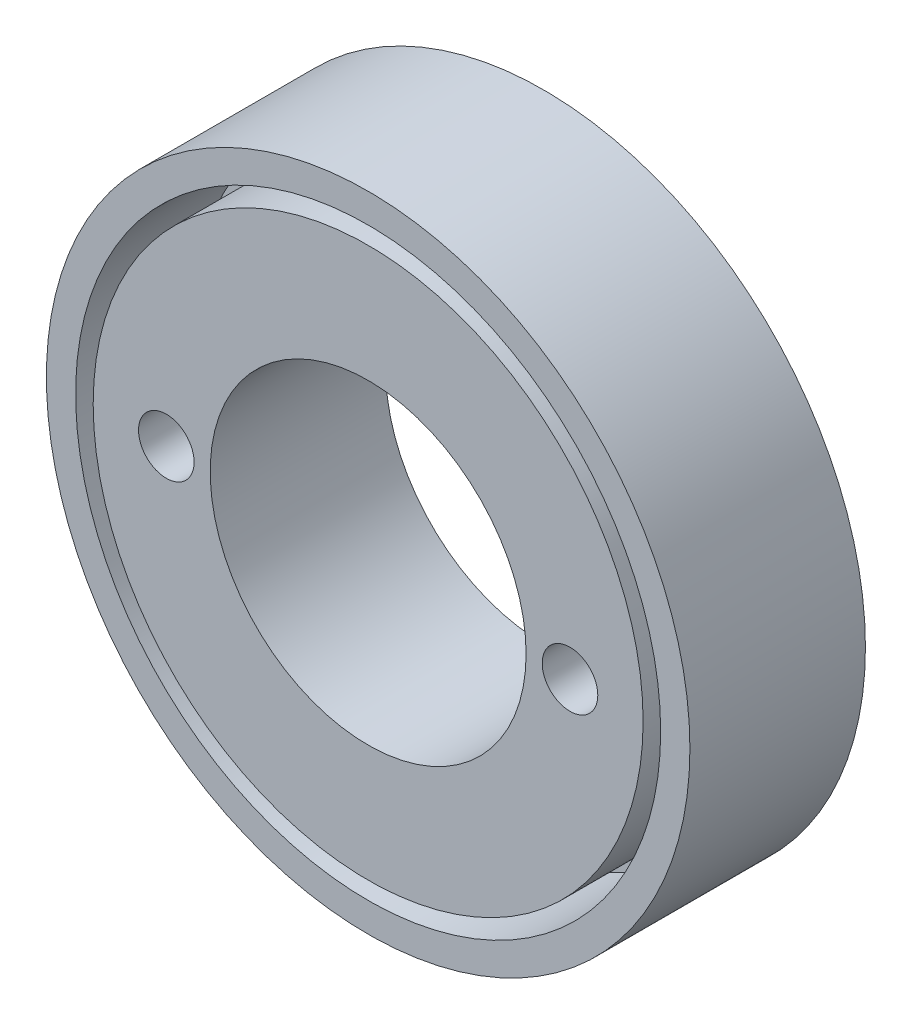
from build123d import *

# Parameters (mm, degrees)
SKETCH1_R           = 55
SKETCH1_R_2         = 27
BOSS_EXTRUDE1_DEPTH = 10
SKETCH2_R           = 55
SKETCH2_R_2         = 50
SKETCH2_R_3         = 47
SKETCH2_R_4         = 4.75
SKETCH2_R_5         = 27
BOSS_EXTRUDE4_DEPTH = 20


with BuildPart() as part:
    # Sketch1 → Boss-Extrude1 (new body)
    with BuildSketch(Plane.XY):
        Circle(SKETCH1_R)
        Circle(SKETCH1_R_2, mode=Mode.SUBTRACT)
    extrude(amount=BOSS_EXTRUDE1_DEPTH)

    # Sketch2 → Boss-Extrude4 (add)
    # profile 1 of 2: a face of its own
    with BuildSketch(Plane.XY.offset(10)):
        Circle(SKETCH2_R)
        Circle(SKETCH2_R_2, mode=Mode.SUBTRACT)
    # profile 2 of 2: a face of its own
    with BuildSketch(Plane.XY.offset(10)):
        Circle(SKETCH2_R_3)
        with Locations((-34.5, 0)):
            Circle(SKETCH2_R_4, mode=Mode.SUBTRACT)
        with Locations((34.5, 0)):
            Circle(SKETCH2_R_4, mode=Mode.SUBTRACT)
        Circle(SKETCH2_R_5, mode=Mode.SUBTRACT)
    extrude(amount=BOSS_EXTRUDE4_DEPTH)


solid = part.part
